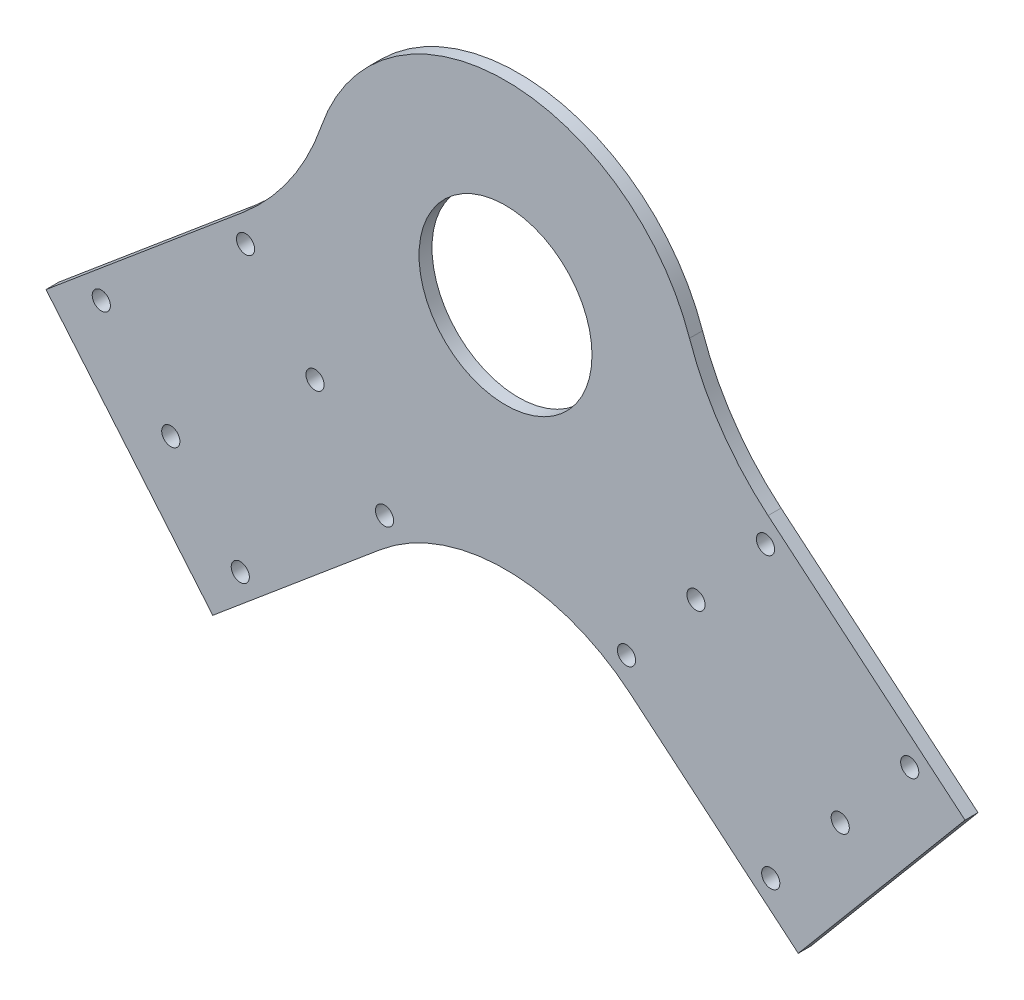
from build123d import *

# Parameters (mm, degrees)
SKETCH1_R           = 2.1
SKETCH1_R_2         = 20
BOSS_EXTRUDE1_DEPTH = 3
FILLET1_R           = 60
FILLET3_R           = 45


with BuildPart() as part:
    # Sketch1 → Boss-Extrude1 (new body)
    with BuildSketch(Plane.XY):
        with BuildLine():
            Line((-106.261095469, -50.001427337), (-67.693838888, -95.964093924))
            Line((-67.693838888, -95.964093924), (0, -39.16221868))
            Line((0, -39.16221868), (67.693838888, -95.964093924))
            Line((67.693838888, -95.964093924), (106.261095469, -50.001427337))
            Line((106.261095469, -50.001427337), (44.97754002, 1.421581438))
            ThreePointArc((44.97754002, 1.421581438), (0, 45), (-44.97754002, 1.421581438))
            Line((-44.97754002, 1.421581438), (-106.261095469, -50.001427337))
        make_face()
        with Locations((-61.332221397, -84.099026587)):
            Circle(SKETCH1_R, mode=Mode.SUBTRACT)
        with Locations((-77.40191164, -64.947915509)):
            Circle(SKETCH1_R, mode=Mode.SUBTRACT)
        with Locations((-93.471601882, -45.796804431)):
            Circle(SKETCH1_R, mode=Mode.SUBTRACT)
        with Locations((-27.978646344, -56.112054061)):
            Circle(SKETCH1_R, mode=Mode.SUBTRACT)
        with Locations((-44.048336586, -36.960942983)):
            Circle(SKETCH1_R, mode=Mode.SUBTRACT)
        with Locations((-60.118026828, -17.809831905)):
            Circle(SKETCH1_R, mode=Mode.SUBTRACT)
        Circle(SKETCH1_R_2, mode=Mode.SUBTRACT)
        with Locations((60.118026828, -17.809831905)):
            Circle(SKETCH1_R, mode=Mode.SUBTRACT)
        with Locations((61.332221397, -84.099026587)):
            Circle(SKETCH1_R, mode=Mode.SUBTRACT)
        with Locations((77.40191164, -64.947915509)):
            Circle(SKETCH1_R, mode=Mode.SUBTRACT)
        with Locations((27.978646344, -56.112054061)):
            Circle(SKETCH1_R, mode=Mode.SUBTRACT)
        with Locations((44.048336586, -36.960942983)):
            Circle(SKETCH1_R, mode=Mode.SUBTRACT)
        with Locations((93.471601882, -45.796804431)):
            Circle(SKETCH1_R, mode=Mode.SUBTRACT)
    extrude(amount=BOSS_EXTRUDE1_DEPTH)

    # Fillet1
    fillet1_edges = [part.edges().sort_by_distance(p)[0] for p in [
        (44.97754002, 1.421581438, 1.5),
        (-44.97754002, 1.421581438, 1.5),
    ]]
    fillet(fillet1_edges, radius=FILLET1_R)

    # Fillet3
    fillet3_edges = [part.edges().sort_by_distance(p)[0] for p in [
        (0, -39.16221868, 1.5),
    ]]
    fillet(fillet3_edges, radius=FILLET3_R)


solid = part.part
